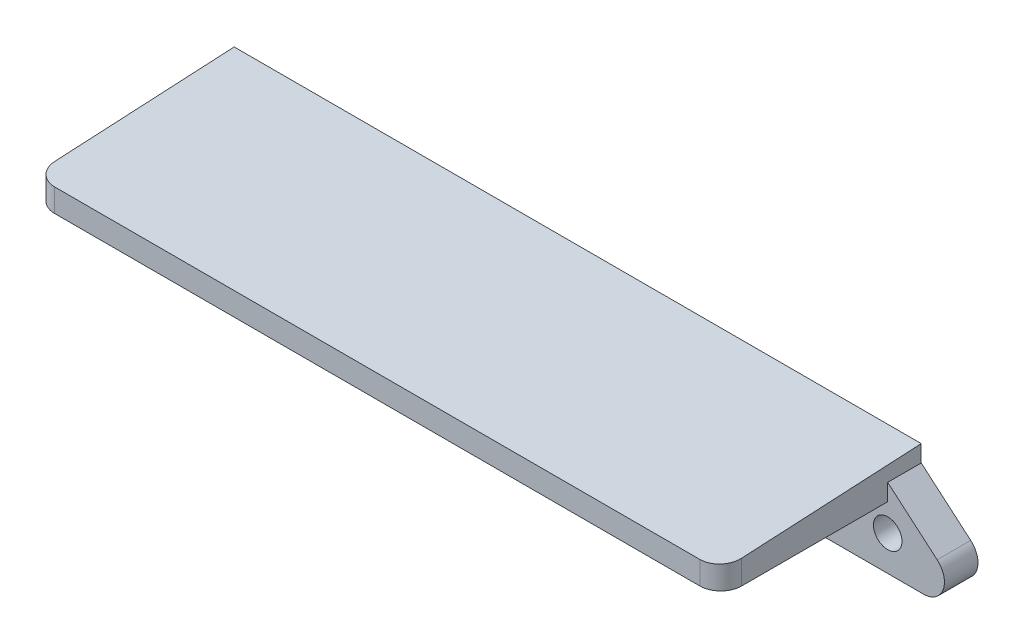
from build123d import *

# Parameters (mm, degrees)
BOSS_EXTRUDE1_DEPTH                             = 4
FILLET1_R                                       = 2.48
SKETCH4_W                                       = 81.9
SKETCH4_H                                       = 4
BOSS_EXTRUDE3_DEPTH                             = 2
SKETCH6_W                                       = 81.9
SKETCH6_H                                       = 4
BOSS_EXTRUDE4_DEPTH                             = 19.9
FILLET3_R                                       = 2.5
SKETCH7_W                                       = 81.9
SKETCH7_H                                       = 35.801674527
CUT_REVOLVE2_ANGLE                              = 3
CSK_FOR_M3_FLAT_HEAD_MACHINE_SCREW1_D           = 3.4
CSK_FOR_M3_FLAT_HEAD_MACHINE_SCREW1_DEPTH       = 10.1
CSK_FOR_M3_FLAT_HEAD_MACHINE_SCREW1_CSINK_D     = 6.3
CSK_FOR_M3_FLAT_HEAD_MACHINE_SCREW1_CSINK_ANGLE = 90
CSK_FOR_M3_FLAT_HEAD_MACHINE_SCREW1_TIP         = 1.021463052


with BuildPart() as part:
    # Sketch1 → Boss-Extrude1 (new body)
    with BuildSketch(Plane.XY):
        Polygon((-51.95, 0), (51.95, 0), (40.95, 9.408805716), (-40.95, 9.408805716), align=None)
    extrude(amount=BOSS_EXTRUDE1_DEPTH)

    # Fillet1
    fillet1_edges = [part.edges().sort_by_distance(p)[0] for p in [
        (51.95, 0, 2),
        (-51.95, 0, 2),
    ]]
    fillet(fillet1_edges, radius=FILLET1_R)

    # Sketch4 → Boss-Extrude3 (add)
    with BuildSketch(Plane(origin=(0, 9.408805716, 0), x_dir=(1, 0, 0), z_dir=(0, 1, 0))):
        with Locations((0, -2)):
            Rectangle(SKETCH4_W, SKETCH4_H)
    extrude(amount=BOSS_EXTRUDE3_DEPTH)

    # Sketch6 → Boss-Extrude4 (add)
    with BuildSketch(Plane.XY.offset(4)):
        with Locations((0, 9.408805716)):
            Rectangle(SKETCH6_W, SKETCH6_H)
    extrude(amount=BOSS_EXTRUDE4_DEPTH)

    # Fillet3
    fillet3_edges = [part.edges().sort_by_distance(p)[0] for p in [
        (-40.95, 9.408805716, 23.9),
        (40.95, 9.408805716, 23.9),
    ]]
    fillet(fillet3_edges, radius=FILLET3_R)

    # Sketch7 → Cut-Revolve2 (revolve, cut)
    with BuildSketch(Plane(origin=(0, 11.408805716, 0), x_dir=(1, 0, 0), z_dir=(0, 1, 0))):
        with Locations((0, -17.900837264)):
            Rectangle(SKETCH7_W, SKETCH7_H)
    revolve(axis=Axis((-40.95, 11.408805716, 0), (1, 0, 0)), revolution_arc=CUT_REVOLVE2_ANGLE, mode=Mode.SUBTRACT)

    # CSK for M3 Flat Head Machine Screw1
    with Locations(Plane(origin=(0, 0, 0), x_dir=(-1, 0, 0), z_dir=(0, 0, -1))):
        with Locations((-40.95, 4.158805716), (40.95, 4.158805716)):
            CounterSinkHole(CSK_FOR_M3_FLAT_HEAD_MACHINE_SCREW1_D / 2, CSK_FOR_M3_FLAT_HEAD_MACHINE_SCREW1_CSINK_D / 2, depth=CSK_FOR_M3_FLAT_HEAD_MACHINE_SCREW1_DEPTH, counter_sink_angle=CSK_FOR_M3_FLAT_HEAD_MACHINE_SCREW1_CSINK_ANGLE)
            with Locations((0, 0, -(CSK_FOR_M3_FLAT_HEAD_MACHINE_SCREW1_DEPTH + CSK_FOR_M3_FLAT_HEAD_MACHINE_SCREW1_TIP / 2))):  # 118° drill point
                Cone(0, CSK_FOR_M3_FLAT_HEAD_MACHINE_SCREW1_D / 2, CSK_FOR_M3_FLAT_HEAD_MACHINE_SCREW1_TIP, mode=Mode.SUBTRACT)


solid = part.part
